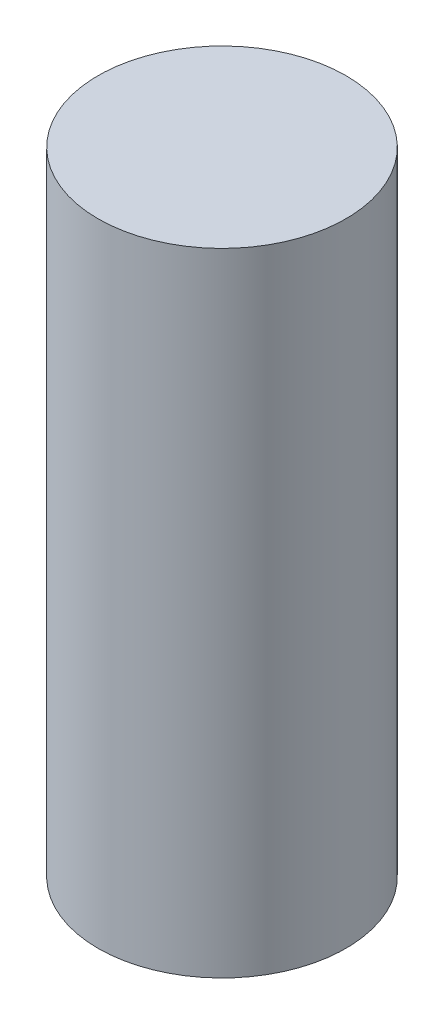
from build123d import *

# Parameters (mm, degrees)
CROQUIS1_R              = 64.75
SALIENTE_EXTRUIR1_DEPTH = 330


with BuildPart() as part:
    # Croquis1 → Saliente-Extruir1 (new body)
    with BuildSketch(Plane(origin=(0, 0, 0), x_dir=(1, 0, 0), z_dir=(0, 1, 0))):
        with Locations(Location((0, 0, 0), (0, 0, 270))):
            Circle(CROQUIS1_R)
    extrude(amount=SALIENTE_EXTRUIR1_DEPTH)


solid = part.part
